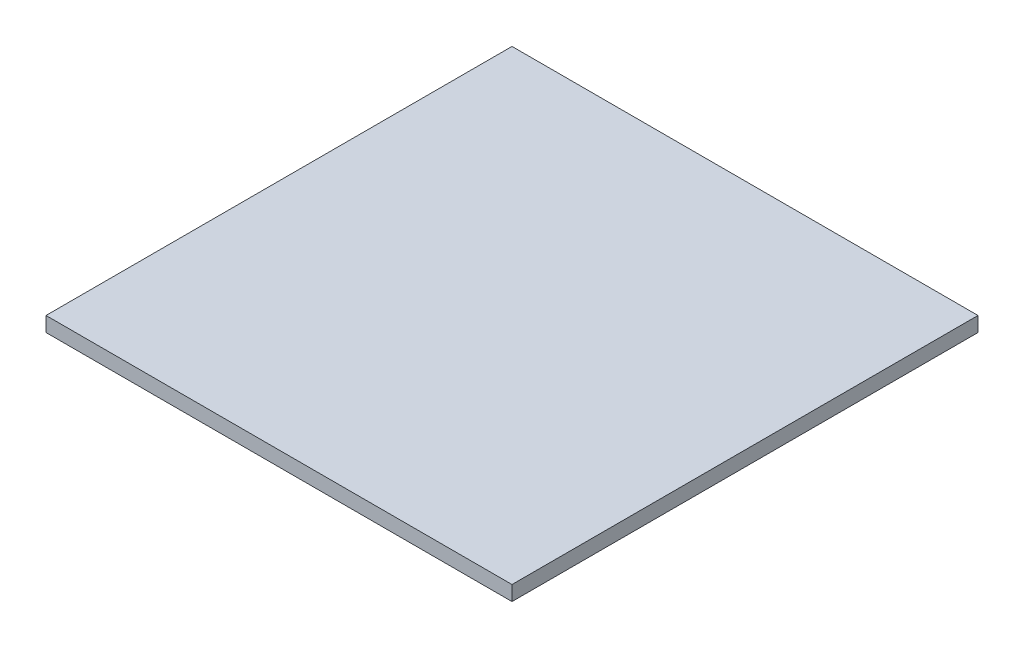
from build123d import *

# Parameters (mm, degrees)
SKETCH1_W           = 100
SKETCH1_H           = 100
BOSS_EXTRUDE1_DEPTH = 3.175


with BuildPart() as part:
    # Sketch1 → Boss-Extrude1 (new body)
    with BuildSketch(Plane(origin=(0, 0, 0), x_dir=(1, 0, 0), z_dir=(0, 1, 0))):
        Rectangle(SKETCH1_W, SKETCH1_H)
    extrude(amount=BOSS_EXTRUDE1_DEPTH)


solid = part.part
